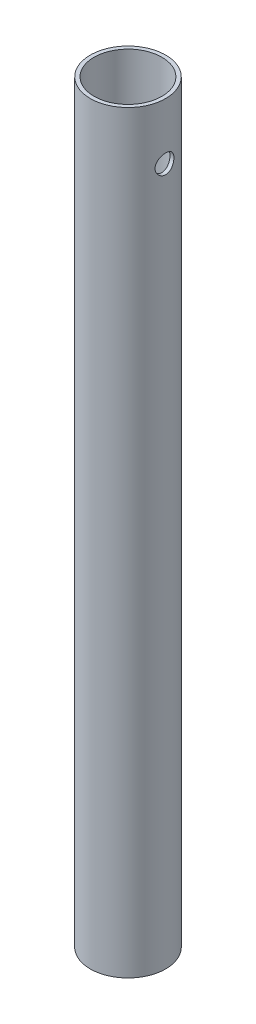
from build123d import *

# Parameters (mm, degrees)
IZIM1_R                     = 10
IZIM1_R_2                   = 9
Y_KSEKLIK_EKSTR_ZYON1_DEPTH = 200
KES_EKSTR_ZYON1_DEPTH       = 20
KES_EKSTR_ZYON1_DEPTH_BACK  = 20
IZIM2_R                     = 2.5


with BuildPart() as part:
    # Çizim1 → Yükseklik-Ekstrüzyon1 (new body)
    with BuildSketch(Plane(origin=(0, 0, 0), x_dir=(1, 0, 0), z_dir=(0, 1, 0))):
        Circle(IZIM1_R)
        Circle(IZIM1_R_2, mode=Mode.SUBTRACT)
    extrude(amount=Y_KSEKLIK_EKSTR_ZYON1_DEPTH)

    # Çizim2 → Kes-Ekstrüzyon1 (cut, two sides: drawn at the far end of the back side and taken through both)
    with BuildSketch(Plane(origin=(0, 0, 0), x_dir=(0, 0, -1), z_dir=(1, 0, 0)).offset(-KES_EKSTR_ZYON1_DEPTH_BACK)):
        with Locations((0, 185)):
            Circle(IZIM2_R)
    extrude(amount=KES_EKSTR_ZYON1_DEPTH + KES_EKSTR_ZYON1_DEPTH_BACK, mode=Mode.SUBTRACT)


solid = part.part
